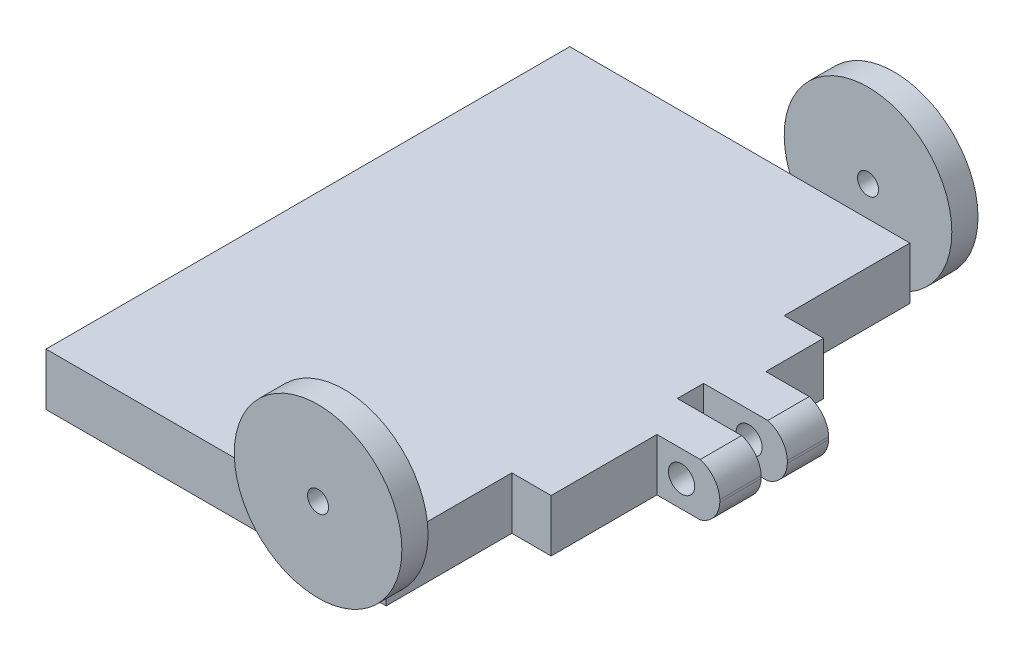
from build123d import *

# Parameters (mm, degrees)
SKETCH1_W                = 53.621579066
SKETCH1_H                = 6.35
BOSS_EXTRUDE2_DEPTH      = 63.5
CUT_EXTRUDE2_DEPTH       = 93.248761228
CUT_EXTRUDE2_DEPTH_BACK  = 0.762
SKETCH3_R                = 1.5875
SKETCH5_R                = 10.16
SKETCH5_R_2              = 1.27
BOSS_EXTRUDE3_DEPTH      = 3.175
BOSS_EXTRUDE4_START      = 3.175
SKETCH6_R                = 10.16
SKETCH6_R_2              = 1.27
BOSS_EXTRUDE4_DEPTH      = 3.175
SKETCH11_W               = 7.62
SKETCH11_H               = 22.225
SKETCH11_H_2             = 28.067
SKETCH11_W_2             = 10.16
SKETCH11_H_3             = 3.175
CUT_EXTRUDE10_DEPTH      = 96.056489111
CUT_EXTRUDE11_DEPTH      = 81.036983958
CUT_EXTRUDE11_DEPTH_BACK = 81.036983958
SKETCH12_W               = 4.7625
SKETCH12_H               = 15.24
CUT_EXTRUDE12_DEPTH      = 96.056489111


with BuildPart() as part:
    # Sketch1 → Boss-Extrude2 (new body)
    with BuildSketch(Plane.XY):
        with Locations((-39.51078952, 5.715)):
            Rectangle(SKETCH1_W, SKETCH1_H)
    extrude(amount=BOSS_EXTRUDE2_DEPTH)

    # Sketch3 → Cut-Extrude2 (cut, two sides: drawn at the far end of the back side and taken through both)
    with BuildSketch(Plane(origin=(0, 0, 63.5), x_dir=(-1, 0, 0), z_dir=(0, 0, -1)).offset(-CUT_EXTRUDE2_DEPTH_BACK)):
        with Locations((17.3355, 5.715)):
            Circle(SKETCH3_R)
    extrude(amount=CUT_EXTRUDE2_DEPTH + CUT_EXTRUDE2_DEPTH_BACK, mode=Mode.SUBTRACT)

    # Sketch5 → Boss-Extrude3 (add)
    with BuildSketch(Plane.XY.offset(63.5)):
        with Locations(Location((-30.1625, 12.573, 0), (0, 0, 201.253809185))):
            Circle(SKETCH5_R)
        with Locations((-30.1625, 12.573)):
            Circle(SKETCH5_R_2, mode=Mode.SUBTRACT)
    extrude(amount=BOSS_EXTRUDE3_DEPTH)

    # Sketch6 → Boss-Extrude4 (add)
    with BuildSketch(Plane(origin=(0, 0, 0), x_dir=(-1, 0, 0), z_dir=(0, 0, -1)).offset(BOSS_EXTRUDE4_START)):
        with Locations(Location((30.1625, 12.573, 0), (0, 0, 338.746190815))):
            Circle(SKETCH6_R)
        with Locations(Location((30.1625, 12.573, 0), (0, 0, 180))):
            Circle(SKETCH6_R_2, mode=Mode.SUBTRACT)
    extrude(amount=-BOSS_EXTRUDE4_DEPTH)

    # Sketch11 → Cut-Extrude10 (cut, through all)
    with BuildSketch(Plane(origin=(0, 8.89, 0), x_dir=(1, 0, 0), z_dir=(0, 1, 0))):
        with Locations((-16.509999987, -11.1125)):
            Rectangle(SKETCH11_W, SKETCH11_H)
        with Locations((-16.509999987, -49.4665)):
            Rectangle(SKETCH11_W, SKETCH11_H_2)
        with Locations((-17.779999987, -28.829)):
            Rectangle(SKETCH11_W_2, SKETCH11_H_3)
    extrude(amount=-CUT_EXTRUDE10_DEPTH, mode=Mode.SUBTRACT)

    # Sketch10 → Cut-Extrude11 (cut, two sides: drawn at the far end of the back side and taken through both)
    with BuildSketch(Plane.XY.offset(35.433).offset(-CUT_EXTRUDE11_DEPTH_BACK)):
        with BuildLine():
            Line((-12.699999987, 8.89), (-15.068097359, 8.89))
            ThreePointArc((-15.068097359, 8.89), (-13.401759428, 7.757904548), (-12.699999987, 5.86955715))
            Line((-12.699999987, 5.86955715), (-12.699999987, 8.89))
        make_face()
        with BuildLine():
            Line((-12.699999987, 2.54), (-12.699999987, 5.56044285))
            ThreePointArc((-12.699999987, 5.56044285), (-13.401759428, 3.672095452), (-15.068097359, 2.54))
            Line((-15.068097359, 2.54), (-12.699999987, 2.54))
        make_face()
    extrude(amount=CUT_EXTRUDE11_DEPTH + CUT_EXTRUDE11_DEPTH_BACK, mode=Mode.SUBTRACT)

    # Sketch12 → Cut-Extrude12 (cut, through all)
    with BuildSketch(Plane(origin=(0, 8.89, 0), x_dir=(1, 0, 0), z_dir=(0, 1, 0))):
        with Locations((-22.701249987, -7.62)):
            Rectangle(SKETCH12_W, SKETCH12_H)
        with Locations((-22.701249987, -55.88)):
            Rectangle(SKETCH12_W, SKETCH12_H)
    extrude(amount=-CUT_EXTRUDE12_DEPTH, mode=Mode.SUBTRACT)


solid = part.part
